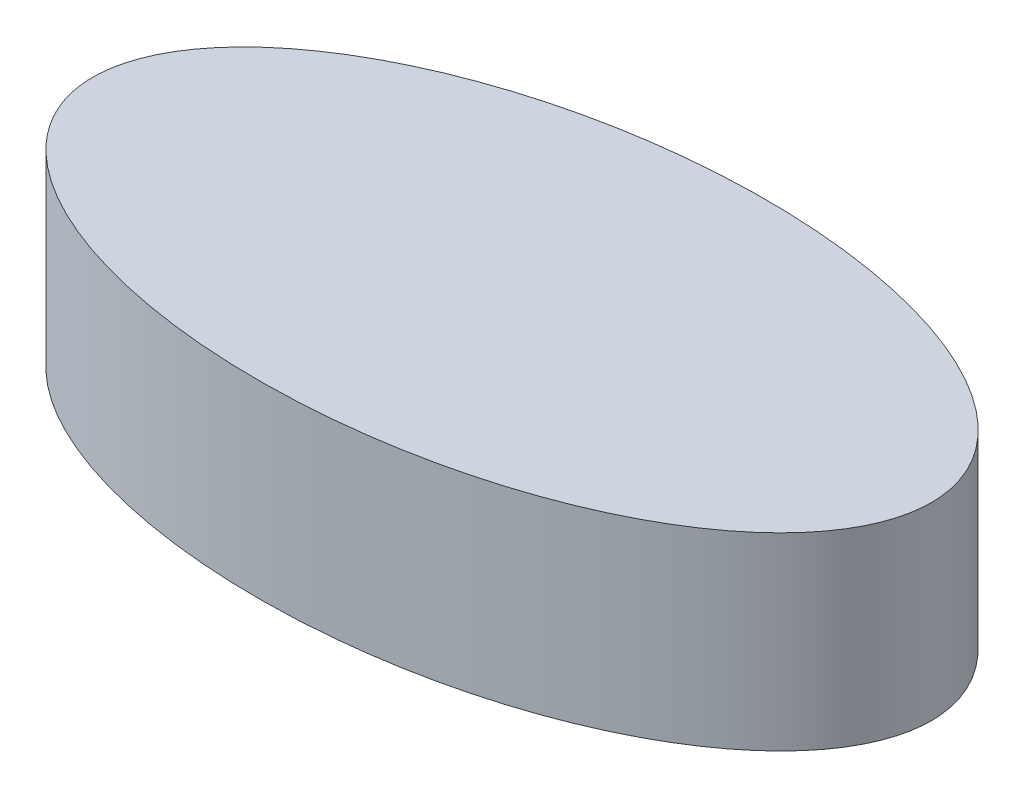
from build123d import *

# Parameters (mm, degrees)
CROQUIS1_RX             = 87.794705126
CROQUIS1_RY             = 45.103289396
SALIENTE_EXTRUIR1_DEPTH = 42


with BuildPart() as part:
    # Croquis1 → Saliente-Extruir1 (new body)
    with BuildSketch(Plane(origin=(0, 0, 0), x_dir=(1, 0, 0), z_dir=(0, 1, 0))):
        with Locations(Location((0, 0), (0, 0, 5.038050641))):
            Ellipse(CROQUIS1_RX, CROQUIS1_RY)
    extrude(amount=SALIENTE_EXTRUIR1_DEPTH)


solid = part.part
